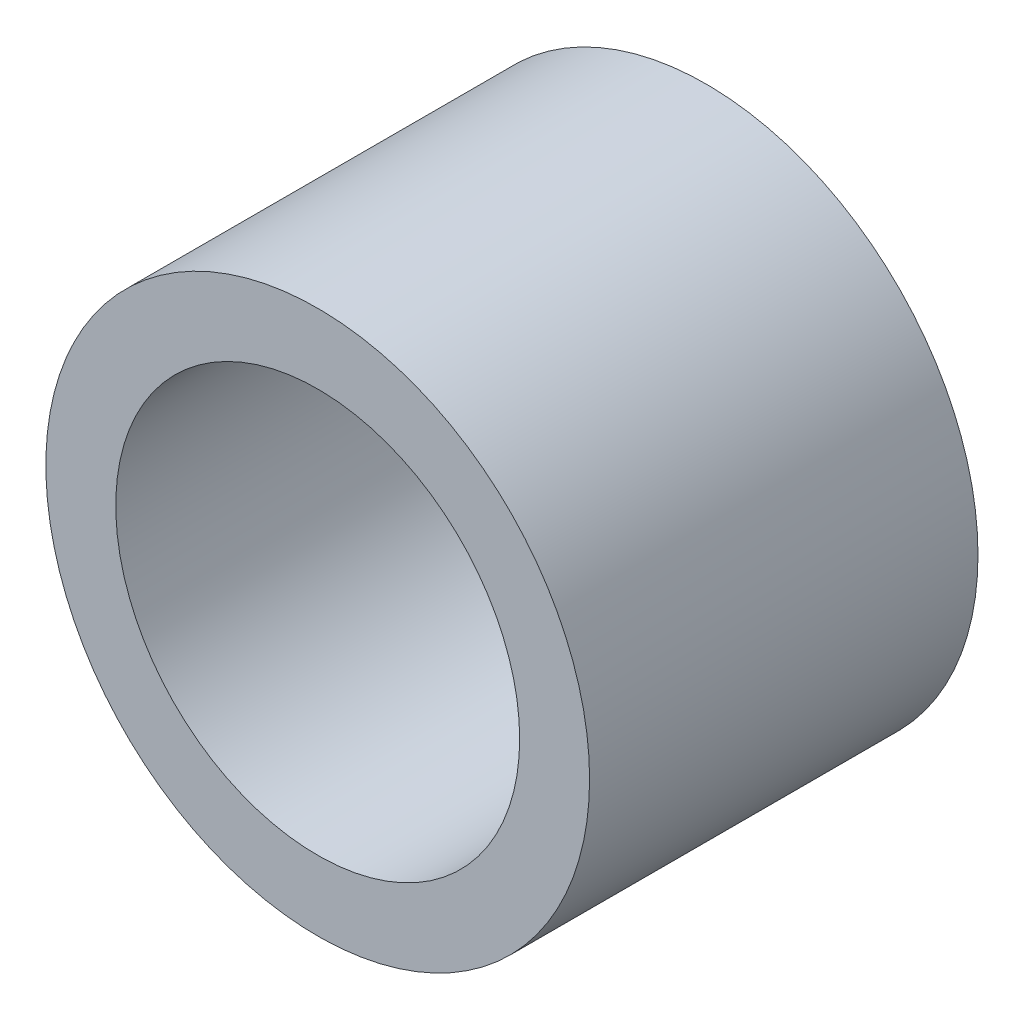
from build123d import *

# Parameters (mm, degrees)
SKETCH_1_R      = 7
SKETCH_1_R_2    = 5.2
EXTRUDE_1_DEPTH = 10


with BuildPart() as part:
    # ｽｹｯﾁ1 → ﾎﾞｽ - 押し出し1 (new body)
    with BuildSketch(Plane.XY):
        Circle(SKETCH_1_R)
        Circle(SKETCH_1_R_2, mode=Mode.SUBTRACT)
    extrude(amount=EXTRUDE_1_DEPTH)


solid = part.part
